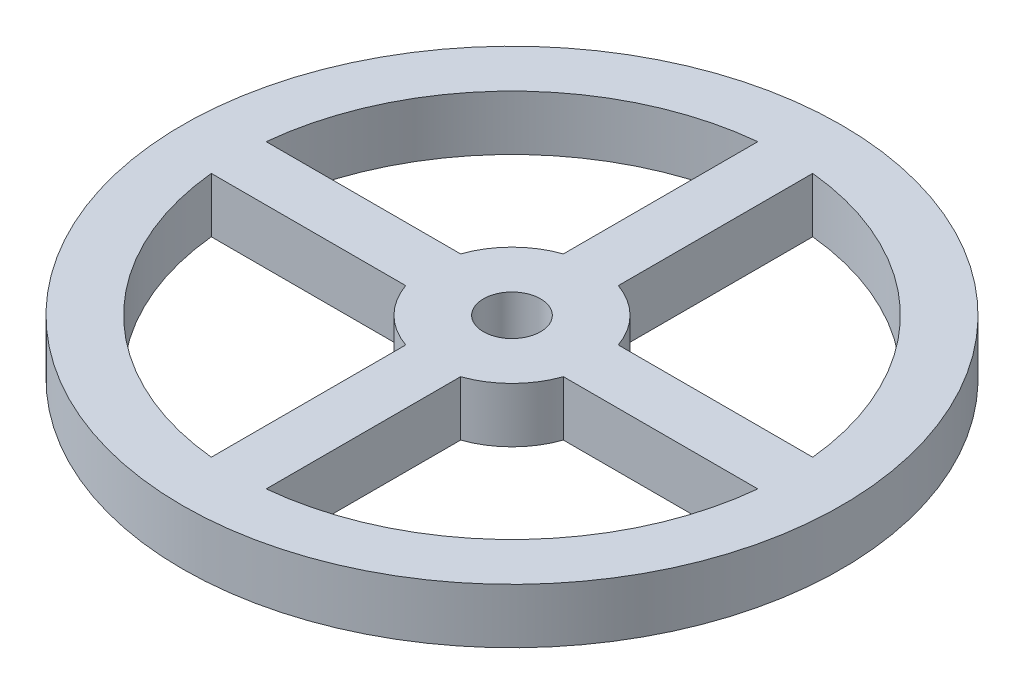
from build123d import *

# Parameters (mm, degrees)
SKETCH1_R           = 38.1
SKETCH1_R_2         = 3.302
BOSS_EXTRUDE1_DEPTH = 6.35
CUT_EXTRUDE4_DEPTH  = 55.254423783
CIRPATTERN1_COUNT   = 4


with BuildPart() as part:
    # Sketch1 → Boss-Extrude1 (new body)
    with BuildSketch(Plane(origin=(0, 0, 0), x_dir=(1, 0, 0), z_dir=(0, 1, 0))):
        with Locations(Location((0, 0, 0), (0, 0, 270))):
            Circle(SKETCH1_R)
        with Locations(Location((0, 0, 0), (0, 0, 270))):
            Circle(SKETCH1_R_2, mode=Mode.SUBTRACT)
    extrude(amount=BOSS_EXTRUDE1_DEPTH)

    # Sketch2 → Cut-Extrude4 (cut, through all)
    with BuildSketch(Plane(origin=(0, 0, 0), x_dir=(1, 0, 0), z_dir=(0, 1, 0))):
        with BuildLine():
            Line((-31.590851128, 3.175), (-9.114849368, 3.175))
            ThreePointArc((-9.114849368, 3.175), (-6.824994652, 6.824994652), (-3.175, 9.114849368))
            Line((-3.175, 9.114849368), (-3.175, 31.590851128))
            ThreePointArc((-3.175, 31.590851128), (-22.450640303, 22.450640303), (-31.590851128, 3.175))
        make_face()
    cut_extrude4 = extrude(amount=CUT_EXTRUDE4_DEPTH, mode=Mode.SUBTRACT)

    # CirPattern1: Cut-Extrude4 ×4 about axis
    cirpattern1_axis = Axis((0, 0, 0), (0, 1, 0))
    for i in range(1, CIRPATTERN1_COUNT):
        add(cut_extrude4.rotate(cirpattern1_axis, i * 360 / CIRPATTERN1_COUNT), mode=Mode.SUBTRACT)


solid = part.part
